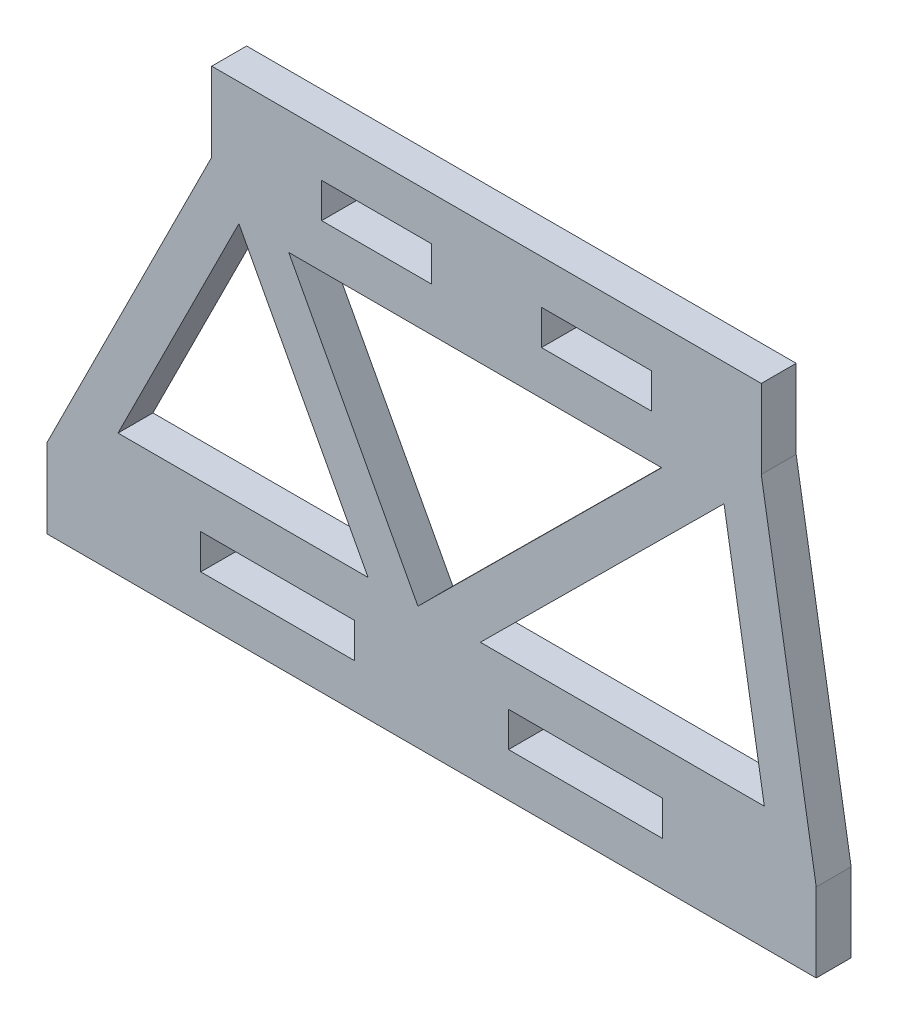
from build123d import *

# Parameters (mm, degrees)
SKETCH1_W           = 10
SKETCH1_H           = 3.175
SKETCH1_W_2         = 14
BOSS_EXTRUDE1_DEPTH = 3.175
CUT_EXTRUDE1_REACH  = 81.323


with BuildPart() as part:
    # Sketch1 → Boss-Extrude1 (new body)
    with BuildSketch(Plane.XY):
        Polygon((15, 30), (0, 0), (0, -7.175), (70, -7.175), (70, 0), (65, 30), (65, 37.175), (15, 37.175), align=None)
        with Locations((30, 31.5875)):
            Rectangle(SKETCH1_W, SKETCH1_H, mode=Mode.SUBTRACT)
        with Locations((21, -1.5875)):
            Rectangle(SKETCH1_W_2, SKETCH1_H, mode=Mode.SUBTRACT)
        with Locations((50, 31.5875)):
            Rectangle(SKETCH1_W, SKETCH1_H, mode=Mode.SUBTRACT)
        with Locations((49, -1.5875)):
            Rectangle(SKETCH1_W_2, SKETCH1_H, mode=Mode.SUBTRACT)
    extrude(amount=BOSS_EXTRUDE1_DEPTH)

    # Sketch2 → Cut-Extrude1 (cut, up to next)
    with BuildSketch(Plane.XY, mode=Mode.PRIVATE) as cut_extrude1_sk1:
        Polygon((61.611491646, 26), (65.278158313, 4), (39.440376301, 4), align=None)
    cut_extrude1_tool1 = extrude(cut_extrude1_sk1.sketch, amount=CUT_EXTRUDE1_REACH, mode=Mode.PRIVATE) & part.part
    # Sketch2 → Cut-Extrude1 (cut, up to next)
    with BuildSketch(Plane.XY, mode=Mode.PRIVATE) as cut_extrude1_sk2:
        Polygon((55.932595363, 26), (33.761480018, 4), (22.00725781, 26), align=None)
    cut_extrude1_tool2 = extrude(cut_extrude1_sk2.sketch, amount=CUT_EXTRUDE1_REACH, mode=Mode.PRIVATE) & part.part
    # Sketch2 → Cut-Extrude1 (cut, up to next)
    with BuildSketch(Plane.XY, mode=Mode.PRIVATE) as cut_extrude1_sk3:
        Polygon((17.472135955, 26), (6.472135955, 4), (29.226358163, 4), align=None)
    cut_extrude1_tool3 = extrude(cut_extrude1_sk3.sketch, amount=CUT_EXTRUDE1_REACH, mode=Mode.PRIVATE) & part.part
    add(cut_extrude1_tool1.solids().sort_by_distance((55.443342, 11.333333, 0))[0], mode=Mode.SUBTRACT)
    add(cut_extrude1_tool2.solids().sort_by_distance((37.233778, 18.666667, 0))[0], mode=Mode.SUBTRACT)
    add(cut_extrude1_tool3.solids().sort_by_distance((17.723543, 11.333333, 0))[0], mode=Mode.SUBTRACT)


solid = part.part
